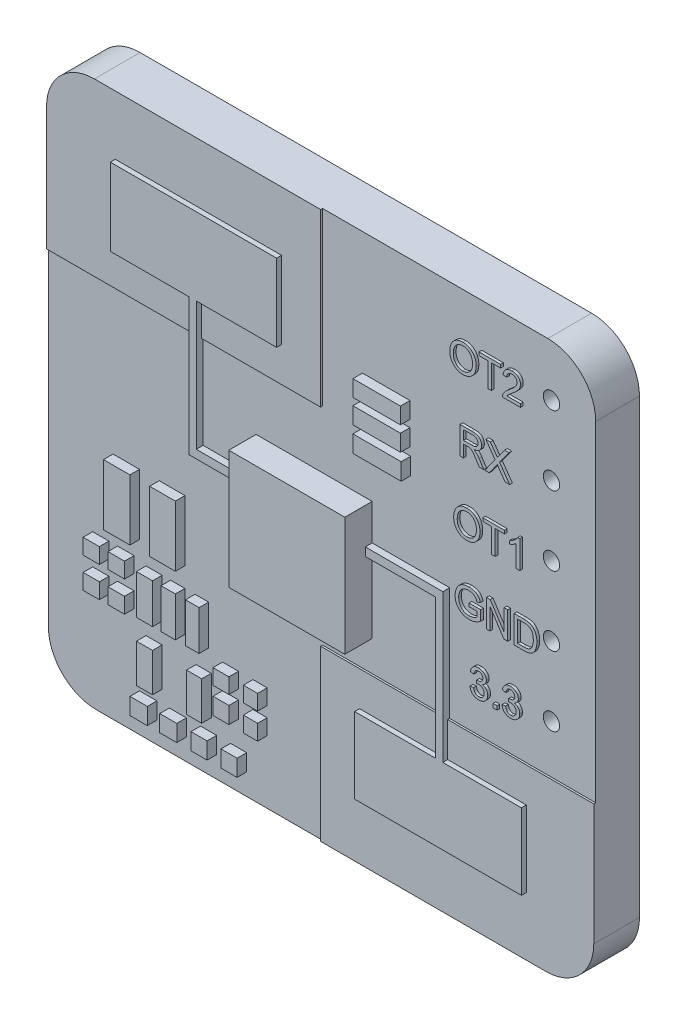
from build123d import *

# Parameters (mm, degrees)
BOSS_EXTRU_1_DEPTH    = 0.25
PUCE_W                = 4.239660345
PUCE_H                = 4.33947132
BOSS_EXTRU_3_DEPTH    = 1
COMPOS_ATES_W         = 0.968097998
COMPOS_ATES_H         = 2.221660789
BOSS_EXTRU_4_DEPTH    = 0.35
COMPOS_ATES_W_2       = 0.940172094
BOSS_EXTRU_4_2_DEPTH  = 0.35
COMPOS_ATES_W_3       = 0.594502212
COMPOS_ATES_H_2       = 0.565693734
BOSS_EXTRU_4_3_DEPTH  = 0.35
COMPOS_ATES_W_4       = 0.604978021
BOSS_EXTRU_4_4_DEPTH  = 0.35
COMPOS_ATES_H_3       = 0.568312687
BOSS_EXTRU_4_5_DEPTH  = 0.35
BOSS_EXTRU_4_6_DEPTH  = 0.35
COMPOS_ATES_W_5       = 0.581460751
COMPOS_ATES_H_4       = 0.561177236
BOSS_EXTRU_4_7_DEPTH  = 0.35
COMPOS_ATES_W_6       = 0.520610207
BOSS_EXTRU_4_8_DEPTH  = 0.35
COMPOS_ATES_H_5       = 0.608505437
BOSS_EXTRU_4_9_DEPTH  = 0.35
COMPOS_ATES_H_6       = 0.567938407
BOSS_EXTRU_4_10_DEPTH = 0.35
COMPOS_ATES_W_7       = 0.635898281
BOSS_EXTRU_4_11_DEPTH = 0.35
COMPOS_ATES_W_8       = 0.622027779
BOSS_EXTRU_4_12_DEPTH = 0.35
COMPOS_ATES_W_9       = 0.588221922
BOSS_EXTRU_4_13_DEPTH = 0.35
COMPOS_ATES_W_10      = 0.588221921
BOSS_EXTRU_4_14_DEPTH = 0.35
COMPOS_ATES_H_7       = 1.406323675
BOSS_EXTRU_4_15_DEPTH = 0.35
COMPOS_ATES_W_11      = 0.554416064
BOSS_EXTRU_4_16_DEPTH = 0.35
COMPOS_ATES_H_8       = 1.453651876
BOSS_EXTRU_4_17_DEPTH = 0.35
COMPOS_ATES_W_12      = 0.523814861
BOSS_EXTRU_4_18_DEPTH = 0.35
COMPOS_ATES_W_13      = 0.496946106
BOSS_EXTRU_4_19_DEPTH = 0.35
COMPOS_ATES_W_14      = 1.738249378
COMPOS_ATES_H_9       = 0.595601276
BOSS_EXTRU_4_20_DEPTH = 0.35
COMPOS_ATES_H_10      = 0.605312167
BOSS_EXTRU_4_21_DEPTH = 0.35
COMPOS_ATES_W_15      = 1.764145085
COMPOS_ATES_H_11      = 0.618260021
BOSS_EXTRU_4_22_DEPTH = 0.35
BOSS_EXTRU_5_DEPTH    = 0.07
BOSS_EXTRU_6_START    = -1.6
PCB_R                 = 0.299595511
BOSS_EXTRU_6_DEPTH    = 1.6
ESQUISSE6_W           = 0.142857143
ESQUISSE6_H           = 0.142857142
BOSS_EXTRU_7_DEPTH    = 0.1


with BuildPart() as part:
    # composants → Boss.-Extru.1 (new body)
    with BuildSketch(Plane.XY):
        Polygon((-82.727562383, 34.479663163), (-82.727562383, 39.174135015), (-79.79361212, 39.174135015), (-79.79361212, 41.997619001), (-85.870529773, 41.997619001), (-85.870529773, 39.174135015), (-82.989687716, 39.174135015), (-82.989687716, 34.479663163), (-82.989687716, 34.176614171), (-82.727562383, 34.176614171), (-73.979075398, 34.176614171), (-73.979075398, 29.073665079), (-76.94287285, 29.073665079), (-76.94287285, 26.301492461), (-70.849203088, 26.301492461), (-70.849203088, 29.073665079), (-73.721056197, 29.073665079), (-73.721056197, 34.176614171), (-73.721056197, 34.479663163), (-73.979075398, 34.479663163), align=None)
    extrude(amount=BOSS_EXTRU_1_DEPTH)

    # puce → Boss.-Extru.3 (add)
    with BuildSketch(Plane.XY):
        with Locations((-78.672400013, 33.624858815)):
            Rectangle(PUCE_W, PUCE_H)
    extrude(amount=BOSS_EXTRU_3_DEPTH)

    # planmasse → Boss.-Extru.5 (add)
    with BuildSketch(Plane.XY):
        with BuildLine():
            Line((-78.364184072, 37.907299389), (-88.38289044, 37.907299389))
            Line((-88.38289044, 37.907299389), (-88.38289044, 42.411344394))
            ThreePointArc((-88.38289044, 42.411344394), (-87.870327307, 43.648781261), (-86.63289044, 44.161344394))
            Line((-86.63289044, 44.161344394), (-78.364184072, 44.161344394))
            Line((-78.364184072, 44.161344394), (-78.364184072, 37.907299389))
        make_face()
        with BuildLine():
            Line((-78.364184072, 30.341178629), (-68.38289044, 30.341178629))
            Line((-68.38289044, 30.341178629), (-68.38289044, 25.911344394))
            ThreePointArc((-68.38289044, 25.911344394), (-68.895453573, 24.673907527), (-70.13289044, 24.161344394))
            Line((-70.13289044, 24.161344394), (-78.364184072, 24.161344394))
            Line((-78.364184072, 24.161344394), (-78.364184072, 30.341178629))
        make_face()
    extrude(amount=BOSS_EXTRU_5_DEPTH)



with BuildPart() as body_2:
    # compos,ates → Boss.-Extru.4 (new body)
    with BuildSketch(Plane.XY):
        with Locations((-85.538547824, 31.447200894)):
            Rectangle(COMPOS_ATES_W, COMPOS_ATES_H)
    extrude(amount=BOSS_EXTRU_4_DEPTH)


with BuildPart() as body_3:
    # compos,ates → Boss.-Extru.4 2 (new body)
    with BuildSketch(Plane.XY):
        with Locations((-83.864545037, 31.447200894)):
            Rectangle(COMPOS_ATES_W_2, COMPOS_ATES_H)
    extrude(amount=BOSS_EXTRU_4_2_DEPTH)


with BuildPart() as body_4:
    # compos,ates → Boss.-Extru.4 3 (new body)
    with BuildSketch(Plane.XY):
        with Locations((-86.468991979, 29.445859909)):
            Rectangle(COMPOS_ATES_W_3, COMPOS_ATES_H_2)
    extrude(amount=BOSS_EXTRU_4_3_DEPTH)


with BuildPart() as body_5:
    # compos,ates → Boss.-Extru.4 4 (new body)
    with BuildSketch(Plane.XY):
        with Locations((-85.554977565, 29.445859909)):
            Rectangle(COMPOS_ATES_W_4, COMPOS_ATES_H_2)
    extrude(amount=BOSS_EXTRU_4_4_DEPTH)


with BuildPart() as body_6:
    # compos,ates → Boss.-Extru.4 5 (new body)
    with BuildSketch(Plane.XY):
        with Locations((-86.468991979, 28.331495632)):
            Rectangle(COMPOS_ATES_W_3, COMPOS_ATES_H_3)
    extrude(amount=BOSS_EXTRU_4_5_DEPTH)


with BuildPart() as body_7:
    # compos,ates → Boss.-Extru.4 6 (new body)
    with BuildSketch(Plane.XY):
        with Locations((-85.554977565, 28.331495632)):
            Rectangle(COMPOS_ATES_W_4, COMPOS_ATES_H_3)
    extrude(amount=BOSS_EXTRU_4_6_DEPTH)


with BuildPart() as body_8:
    # compos,ates → Boss.-Extru.4 7 (new body)
    with BuildSketch(Plane.XY):
        with Locations((-81.727654281, 27.695281108)):
            Rectangle(COMPOS_ATES_W_5, COMPOS_ATES_H_4)
    extrude(amount=BOSS_EXTRU_4_7_DEPTH)


with BuildPart() as body_9:
    # compos,ates → Boss.-Extru.4 8 (new body)
    with BuildSketch(Plane.XY):
        with Locations((-80.649247424, 27.695281108)):
            Rectangle(COMPOS_ATES_W_6, COMPOS_ATES_H_4)
    extrude(amount=BOSS_EXTRU_4_8_DEPTH)


with BuildPart() as body_10:
    # compos,ates → Boss.-Extru.4 9 (new body)
    with BuildSketch(Plane.XY):
        with Locations((-81.727654281, 26.765620025)):
            Rectangle(COMPOS_ATES_W_5, COMPOS_ATES_H_5)
    extrude(amount=BOSS_EXTRU_4_9_DEPTH)


with BuildPart() as body_11:
    # compos,ates → Boss.-Extru.4 10 (new body)
    with BuildSketch(Plane.XY):
        with Locations((-80.649247424, 26.74533651)):
            Rectangle(COMPOS_ATES_W_6, COMPOS_ATES_H_6)
    extrude(amount=BOSS_EXTRU_4_10_DEPTH)


with BuildPart() as body_12:
    # compos,ates → Boss.-Extru.4 11 (new body)
    with BuildSketch(Plane.XY):
        with Locations((-84.736549685, 25.244356434)):
            Rectangle(COMPOS_ATES_W_7, COMPOS_ATES_H_5)
    extrude(amount=BOSS_EXTRU_4_11_DEPTH)


with BuildPart() as body_13:
    # compos,ates → Boss.-Extru.4 12 (new body)
    with BuildSketch(Plane.XY):
        with Locations((-83.654588163, 25.244356434)):
            Rectangle(COMPOS_ATES_W_8, COMPOS_ATES_H_5)
    extrude(amount=BOSS_EXTRU_4_12_DEPTH)


with BuildPart() as body_14:
    # compos,ates → Boss.-Extru.4 13 (new body)
    with BuildSketch(Plane.XY):
        with Locations((-82.528853105, 25.244356434)):
            Rectangle(COMPOS_ATES_W_9, COMPOS_ATES_H_5)
    extrude(amount=BOSS_EXTRU_4_13_DEPTH)


with BuildPart() as body_15:
    # compos,ates → Boss.-Extru.4 14 (new body)
    with BuildSketch(Plane.XY):
        with Locations((-81.43354332, 25.244356434)):
            Rectangle(COMPOS_ATES_W_10, COMPOS_ATES_H_5)
    extrude(amount=BOSS_EXTRU_4_14_DEPTH)


with BuildPart() as body_16:
    # compos,ates → Boss.-Extru.4 15 (new body)
    with BuildSketch(Plane.XY):
        with Locations((-84.523398702, 26.711530653)):
            Rectangle(COMPOS_ATES_W_9, COMPOS_ATES_H_7)
    extrude(amount=BOSS_EXTRU_4_15_DEPTH)


with BuildPart() as body_17:
    # compos,ates → Boss.-Extru.4 16 (new body)
    with BuildSketch(Plane.XY):
        with Locations((-82.70802415, 26.711530653)):
            Rectangle(COMPOS_ATES_W_11, COMPOS_ATES_H_7)
    extrude(amount=BOSS_EXTRU_4_16_DEPTH)


with BuildPart() as body_18:
    # compos,ates → Boss.-Extru.4 17 (new body)
    with BuildSketch(Plane.XY):
        with Locations((-84.523398702, 28.892008466)):
            Rectangle(COMPOS_ATES_W_9, COMPOS_ATES_H_8)
    extrude(amount=BOSS_EXTRU_4_17_DEPTH)


with BuildPart() as body_19:
    # compos,ates → Boss.-Extru.4 18 (new body)
    with BuildSketch(Plane.XY):
        with Locations((-83.656366421, 28.892008466)):
            Rectangle(COMPOS_ATES_W_12, COMPOS_ATES_H_8)
    extrude(amount=BOSS_EXTRU_4_18_DEPTH)


with BuildPart() as body_20:
    # compos,ates → Boss.-Extru.4 19 (new body)
    with BuildSketch(Plane.XY):
        with Locations((-82.777326158, 28.892008466)):
            Rectangle(COMPOS_ATES_W_13, COMPOS_ATES_H_8)
    extrude(amount=BOSS_EXTRU_4_19_DEPTH)


with BuildPart() as body_21:
    # compos,ates → Boss.-Extru.4 20 (new body)
    with BuildSketch(Plane.XY):
        with Locations((-76.03749441, 39.38072464)):
            Rectangle(COMPOS_ATES_W_14, COMPOS_ATES_H_9)
    extrude(amount=BOSS_EXTRU_4_20_DEPTH)


with BuildPart() as body_22:
    # compos,ates → Boss.-Extru.4 21 (new body)
    with BuildSketch(Plane.XY):
        with Locations((-76.03749441, 38.518073878)):
            Rectangle(COMPOS_ATES_W_14, COMPOS_ATES_H_10)
    extrude(amount=BOSS_EXTRU_4_21_DEPTH)


with BuildPart() as body_23:
    # compos,ates → Boss.-Extru.4 22 (new body)
    with BuildSketch(Plane.XY):
        with Locations((-76.024546557, 37.621435)):
            Rectangle(COMPOS_ATES_W_15, COMPOS_ATES_H_11)
    extrude(amount=BOSS_EXTRU_4_22_DEPTH)


with BuildPart() as part_1:
    add(part.part)

    add(body_2.part)  # Boss.-Extru.6 merges body 2

    add(body_3.part)  # Boss.-Extru.6 merges body 3

    add(body_4.part)  # Boss.-Extru.6 merges body 4

    add(body_5.part)  # Boss.-Extru.6 merges body 5

    add(body_6.part)  # Boss.-Extru.6 merges body 6

    add(body_7.part)  # Boss.-Extru.6 merges body 7

    add(body_8.part)  # Boss.-Extru.6 merges body 8

    add(body_9.part)  # Boss.-Extru.6 merges body 9

    add(body_10.part)  # Boss.-Extru.6 merges body 10

    add(body_11.part)  # Boss.-Extru.6 merges body 11

    add(body_12.part)  # Boss.-Extru.6 merges body 12

    add(body_13.part)  # Boss.-Extru.6 merges body 13

    add(body_14.part)  # Boss.-Extru.6 merges body 14

    add(body_15.part)  # Boss.-Extru.6 merges body 15

    add(body_16.part)  # Boss.-Extru.6 merges body 16

    add(body_17.part)  # Boss.-Extru.6 merges body 17

    add(body_18.part)  # Boss.-Extru.6 merges body 18

    add(body_19.part)  # Boss.-Extru.6 merges body 19

    add(body_20.part)  # Boss.-Extru.6 merges body 20

    add(body_21.part)  # Boss.-Extru.6 merges body 21

    add(body_22.part)  # Boss.-Extru.6 merges body 22

    add(body_23.part)  # Boss.-Extru.6 merges body 23
    # pcb → Boss.-Extru.6 (add)
    with BuildSketch(Plane.XY.offset(BOSS_EXTRU_6_START)):
        with BuildLine():
            Line((-88.38289044, 42.411344394), (-88.38289044, 37.932925771))
            Line((-88.38289044, 37.932925771), (-88.38289044, 25.911344394))
            ThreePointArc((-88.38289044, 25.911344394), (-87.870327307, 24.673907527), (-86.63289044, 24.161344394))
            Line((-86.63289044, 24.161344394), (-70.13289044, 24.161344394))
            ThreePointArc((-70.13289044, 24.161344394), (-68.895453573, 24.673907527), (-68.38289044, 25.911344394))
            Line((-68.38289044, 25.911344394), (-68.38289044, 42.411344394))
            ThreePointArc((-68.38289044, 42.411344394), (-68.895453573, 43.648781261), (-70.13289044, 44.161344394))
            Line((-70.13289044, 44.161344394), (-86.63289044, 44.161344394))
            ThreePointArc((-86.63289044, 44.161344394), (-87.870327307, 43.648781261), (-88.38289044, 42.411344394))
        make_face()
        with Locations((-69.999251018, 32.112389016)):
            Circle(PCB_R, mode=Mode.SUBTRACT)
        with Locations((-69.999251018, 34.652389016)):
            Circle(PCB_R, mode=Mode.SUBTRACT)
        with Locations((-69.999251018, 37.192389016)):
            Circle(PCB_R, mode=Mode.SUBTRACT)
        with Locations((-69.999251018, 39.732389016)):
            Circle(PCB_R, mode=Mode.SUBTRACT)
        with Locations((-69.999251018, 42.272389016)):
            Circle(PCB_R, mode=Mode.SUBTRACT)
    extrude(amount=BOSS_EXTRU_6_DEPTH)

    # Esquisse6 → Boss.-Extru.7 (add)
    # profile 1 of 14: a face of its own
    with BuildSketch(Plane.XY):
        with BuildLine():
            add(Edge.make_bspline(
                [(-72.416988653, 32.110058179), (-72.409381043, 32.108428609), (-72.394470894, 32.105234815), (-72.373021148, 32.09833025), (-72.353148019, 32.089491337), (-72.334478472, 32.079468666), (-72.317495516, 32.06726849), (-72.301917932, 32.053541092), (-72.287730346, 32.038083432), (-72.275077561, 32.021185831), (-72.264120415, 32.003157669), (-72.254213405, 31.984796941), (-72.245929262, 31.966004093), (-72.239180953, 31.946728119), (-72.233884703, 31.927136894), (-72.230259257, 31.907038916), (-72.22796943, 31.886626243), (-72.227629699, 31.87284821), (-72.227459432, 31.865942919)],
                knots=[0, 0, 0, 0, 1.108697074, 2.172934788, 3.204880389, 4.206093888, 5.188037506, 6.178607442, 7.161308294, 8.17378834, 9.182634384, 10.166186428, 11.146234401, 12.106878305, 13.075234477, 14.036023556, 15.015691959, 16, 16, 16, 16], degree=3))
            add(Edge.make_bspline(
                [(-72.227459432, 31.865942919), (-72.227798259, 31.854903758), (-72.228464178, 31.833207793), (-72.232908352, 31.801410743), (-72.24064398, 31.771201942), (-72.25155368, 31.742528078), (-72.265288802, 31.715179707), (-72.282531694, 31.689597615), (-72.302573714, 31.665380293), (-72.325569394, 31.643168434), (-72.350601927, 31.622982407), (-72.377080684, 31.60524909), (-72.404740101, 31.590107136), (-72.433744752, 31.57794908), (-72.463869962, 31.568297448), (-72.495291428, 31.561707819), (-72.527873795, 31.557513252), (-72.550024869, 31.556966926), (-72.56126625, 31.556689673)],
                knots=[0, 0, 0, 0, 1.04348772, 2.050832607, 3.027849651, 3.985018456, 4.945832333, 5.91410632, 6.89488226, 7.912262782, 8.930828092, 9.931024771, 10.921011636, 11.90669419, 12.899588269, 13.906628715, 14.937641313, 16, 16, 16, 16], degree=3))
            add(Edge.make_bspline(
                [(-72.56126625, 31.556689673), (-72.571966035, 31.556906011), (-72.592956544, 31.557330416), (-72.623673767, 31.561179908), (-72.653030824, 31.566815077), (-72.680782795, 31.575591212), (-72.707347994, 31.586199798), (-72.732291904, 31.599694389), (-72.755844255, 31.615482759), (-72.777887225, 31.63339269), (-72.797926272, 31.653579664), (-72.816061193, 31.675216168), (-72.831812835, 31.698656212), (-72.845379446, 31.723500109), (-72.856623535, 31.750038686), (-72.865697019, 31.778009444), (-72.872727027, 31.807594594), (-72.875431882, 31.827965815), (-72.876810081, 31.838345517)],
                knots=[0, 0, 0, 0, 1.097840809, 2.15371029, 3.173627445, 4.161928108, 5.136697, 6.10591076, 7.066857035, 8.04392302, 9.016042305, 9.982391694, 10.93757629, 11.910092237, 12.8837972, 13.891636589, 14.925730372, 16, 16, 16, 16], degree=3))
            Line((-72.876810081, 31.838345517), (-72.746939951, 31.855390971))
            add(Edge.make_bspline(
                [(-72.746939951, 31.855390971), (-72.745417215, 31.847454367), (-72.742456454, 31.832022678), (-72.736477324, 31.809904636), (-72.729841725, 31.789258938), (-72.722118067, 31.770131538), (-72.713492221, 31.752527267), (-72.703840422, 31.736559327), (-72.693486012, 31.72202833), (-72.682148433, 31.708954667), (-72.669647919, 31.697600214), (-72.656441204, 31.687507517), (-72.642126848, 31.679136717), (-72.626822044, 31.672492265), (-72.610660495, 31.667168851), (-72.593549518, 31.663289406), (-72.575460514, 31.661090131), (-72.563098338, 31.660755972), (-72.556801964, 31.660585776)],
                knots=[0, 0, 0, 0, 1.291404279, 2.510966685, 3.659843074, 4.756126606, 5.80544111, 6.790091746, 7.735305102, 8.654813164, 9.550164339, 10.430304926, 11.307451716, 12.193417606, 13.092677492, 14.023872142, 14.99350733, 16, 16, 16, 16], degree=3))
            add(Edge.make_bspline(
                [(-72.556801964, 31.660585776), (-72.549964033, 31.660813976), (-72.536508367, 31.661263026), (-72.516681702, 31.663821369), (-72.497786945, 31.668643324), (-72.479515645, 31.674797637), (-72.462274368, 31.68336727), (-72.445470288, 31.693142611), (-72.429907374, 31.705336541), (-72.415102682, 31.718832681), (-72.401641736, 31.733707711), (-72.389771644, 31.749584082), (-72.379827355, 31.766367582), (-72.371376714, 31.783804407), (-72.365059539, 31.802286256), (-72.360744577, 31.821554944), (-72.357658537, 31.841561686), (-72.357440336, 31.855175904), (-72.357329562, 31.8620874)],
                knots=[0, 0, 0, 0, 1.039414619, 2.045357549, 3.030071188, 3.998775674, 4.968788042, 5.950654362, 6.947736046, 7.966204168, 8.99226847, 9.991361361, 10.97322768, 11.952508152, 12.930925156, 13.933238126, 14.950772207, 16, 16, 16, 16], degree=3))
            add(Edge.make_bspline(
                [(-72.357329562, 31.8620874), (-72.357455261, 31.868727025), (-72.357701305, 31.881723486), (-72.360532452, 31.900791619), (-72.364639681, 31.919059805), (-72.370794757, 31.936384888), (-72.378646055, 31.95277743), (-72.387893245, 31.968477871), (-72.399218171, 31.983176915), (-72.412138838, 31.996826402), (-72.42627289, 32.009395718), (-72.441542496, 32.020517174), (-72.458067993, 32.029537201), (-72.475483299, 32.037198618), (-72.494004661, 32.04301293), (-72.513547397, 32.047322451), (-72.534148792, 32.049739798), (-72.548205505, 32.050041928), (-72.55538151, 32.050196166)],
                knots=[0, 0, 0, 0, 1.039520793, 2.03476737, 3.014257368, 3.969595977, 4.908269218, 5.858892987, 6.819157264, 7.808857987, 8.799919747, 9.779409745, 10.761476676, 11.744001019, 12.756257763, 13.797775717, 14.875756186, 16, 16, 16, 16], degree=3))
            add(Edge.make_bspline(
                [(-72.55538151, 32.050196166), (-72.5616788, 32.05002262), (-72.574991195, 32.049655745), (-72.595924557, 32.047015727), (-72.618889046, 32.042975192), (-72.634742386, 32.039190811), (-72.643043847, 32.037209153)],
                knots=[0, 0, 0, 0, 0.850710824, 1.798392532, 2.847147604, 4, 4, 4, 4], degree=3))
            Line((-72.643043847, 32.037209153), (-72.629042224, 32.15409227))
            add(Edge.make_bspline(
                [(-72.629042224, 32.15409227), (-72.621396261, 32.154073812), (-72.606975772, 32.154039), (-72.586626009, 32.155288806), (-72.568792195, 32.156242667), (-72.552828032, 32.158299236), (-72.537778851, 32.16170353), (-72.522332838, 32.166397518), (-72.506197003, 32.173021337), (-72.489340754, 32.180876199), (-72.472826731, 32.190680959), (-72.457423633, 32.202467734), (-72.443840965, 32.216490137), (-72.43149511, 32.23204319), (-72.421415534, 32.249825867), (-72.414382709, 32.269740744), (-72.409990196, 32.291617635), (-72.409521487, 32.306870424), (-72.409277614, 32.314806556)],
                knots=[0, 0, 0, 0, 1.189476569, 2.243384405, 3.171816706, 3.968247766, 4.74460194, 5.57033408, 6.477275893, 7.456583362, 8.462071333, 9.460038224, 10.464864835, 11.49237022, 12.543383061, 13.628830431, 14.766264109, 16, 16, 16, 16], degree=3))
            add(Edge.make_bspline(
                [(-72.409277614, 32.314806556), (-72.409464726, 32.320627753), (-72.409829218, 32.331967366), (-72.411755872, 32.34851952), (-72.415485985, 32.363996576), (-72.420463958, 32.378579452), (-72.427369214, 32.391970136), (-72.435125666, 32.404719478), (-72.444849824, 32.416117009), (-72.459357872, 32.429706655), (-72.479445741, 32.444117573), (-72.505926487, 32.45656078), (-72.534292876, 32.46453397), (-72.553907703, 32.465359736), (-72.563904237, 32.465780582)],
                knots=[0, 0, 0, 0, 0.865373357, 1.68573535, 2.470791522, 3.227405046, 3.969116108, 4.705358259, 5.440226823, 6.186825656, 7.656768999, 9.091088923, 10.517497636, 12, 12, 12, 12], degree=3))
            add(Edge.make_bspline(
                [(-72.563904237, 32.465780582), (-72.569592762, 32.465611729), (-72.580810735, 32.465278745), (-72.597196766, 32.463043468), (-72.612805486, 32.459321888), (-72.627662169, 32.454386883), (-72.641570118, 32.447479832), (-72.65478449, 32.439464629), (-72.667115457, 32.429725075), (-72.678575516, 32.418624507), (-72.68919874, 32.406250247), (-72.698562364, 32.392421024), (-72.707083677, 32.37744226), (-72.714560996, 32.361132773), (-72.721126756, 32.34366714), (-72.726242513, 32.324868991), (-72.730855244, 32.304927013), (-72.732900828, 32.291082888), (-72.733952938, 32.2839624)],
                knots=[0, 0, 0, 0, 0.991350633, 1.954978605, 2.875684831, 3.785306039, 4.676327725, 5.576040997, 6.474517762, 7.408263042, 8.35317801, 9.311237712, 10.314294325, 11.353349771, 12.435063167, 13.562077035, 14.746096111, 16, 16, 16, 16], degree=3))
            Line((-72.733952938, 32.2839624), (-72.863823068, 32.306689673))
            add(Edge.make_bspline(
                [(-72.863823068, 32.306689673), (-72.861772628, 32.31735321), (-72.857752404, 32.338260832), (-72.848801153, 32.368120264), (-72.838928371, 32.396201559), (-72.826472383, 32.421830306), (-72.812902776, 32.445796697), (-72.796844715, 32.467224438), (-72.779598397, 32.487058862), (-72.760213086, 32.504387563), (-72.739616212, 32.51978539), (-72.717869368, 32.53300434), (-72.695331353, 32.5445941), (-72.67153397, 32.553464994), (-72.647012066, 32.561062858), (-72.62135286, 32.565960484), (-72.594760306, 32.569117253), (-72.576697658, 32.569488707), (-72.567556834, 32.569676686)],
                knots=[0, 0, 0, 0, 1.196598026, 2.346127519, 3.433890862, 4.474795076, 5.484142389, 6.465743017, 7.422110934, 8.377896977, 9.32664338, 10.254070249, 11.18137714, 12.11636131, 13.050809827, 14.008921245, 14.99239035, 16, 16, 16, 16], degree=3))
            add(Edge.make_bspline(
                [(-72.567556834, 32.569676686), (-72.557469168, 32.569433613), (-72.537706942, 32.568957423), (-72.508694212, 32.565488396), (-72.481015984, 32.559546942), (-72.454514608, 32.551537369), (-72.429440492, 32.540828296), (-72.405512648, 32.528050845), (-72.382980014, 32.512688306), (-72.361731357, 32.495430906), (-72.34271025, 32.4762064), (-72.325592875, 32.456108304), (-72.311345244, 32.434696204), (-72.29973679, 32.412206557), (-72.29044921, 32.38872102), (-72.284053477, 32.364120732), (-72.280018796, 32.3384793), (-72.279613719, 32.321044891), (-72.279407484, 32.312168569)],
                knots=[0, 0, 0, 0, 1.123761111, 2.201502124, 3.249427722, 4.274422765, 5.280770574, 6.282168429, 7.291699599, 8.314503797, 9.32695594, 10.300518959, 11.251508239, 12.185140702, 13.11575736, 14.058951515, 15.011760414, 16, 16, 16, 16], degree=3))
            add(Edge.make_bspline(
                [(-72.279407484, 32.312168569), (-72.279849852, 32.30098015), (-72.280709825, 32.27922965), (-72.286983267, 32.247811289), (-72.297949015, 32.218961225), (-72.313066935, 32.19239691), (-72.332888234, 32.168537714), (-72.356765514, 32.146979193), (-72.385023402, 32.127978378), (-72.406088599, 32.117907354), (-72.416988653, 32.112696166)],
                knots=[0, 0, 0, 0, 1.039587536, 2.020978204, 2.96205572, 3.896981787, 4.848417189, 5.832040328, 6.87820286, 8, 8, 8, 8], degree=3))
            Line((-72.416988653, 32.112696166), (-72.416988653, 32.110058179))
        make_face()
    # profile 2 of 14: a face of its own
    with BuildSketch(Plane.XY):
        with Locations((-71.961225665, 31.641105257)):
            Rectangle(ESQUISSE6_W, ESQUISSE6_H)
    # profile 3 of 14: a face of its own
    with BuildSketch(Plane.XY):
        with BuildLine():
            add(Edge.make_bspline(
                [(-71.248157484, 32.110058179), (-71.240549874, 32.108428609), (-71.225639725, 32.105234815), (-71.204189979, 32.09833025), (-71.18431685, 32.089491337), (-71.165647303, 32.079468666), (-71.148664347, 32.06726849), (-71.133086763, 32.053541092), (-71.118899177, 32.038083432), (-71.106246392, 32.021185831), (-71.095289246, 32.003157669), (-71.085382237, 31.984796941), (-71.077098093, 31.966004093), (-71.070349784, 31.946728119), (-71.065053534, 31.927136894), (-71.061428088, 31.907038916), (-71.059138261, 31.886626243), (-71.05879853, 31.87284821), (-71.058628263, 31.865942919)],
                knots=[0, 0, 0, 0, 1.108697074, 2.172934788, 3.204880389, 4.206093888, 5.188037506, 6.178607442, 7.161308294, 8.17378834, 9.182634384, 10.166186428, 11.146234401, 12.106878305, 13.075234477, 14.036023556, 15.015691959, 16, 16, 16, 16], degree=3))
            add(Edge.make_bspline(
                [(-71.058628263, 31.865942919), (-71.058967091, 31.854903758), (-71.05963301, 31.833207793), (-71.064077183, 31.801410743), (-71.071812811, 31.771201942), (-71.082722511, 31.742528078), (-71.096457633, 31.715179707), (-71.113700526, 31.689597615), (-71.133742545, 31.665380293), (-71.156738225, 31.643168434), (-71.181770758, 31.622982407), (-71.208249516, 31.60524909), (-71.235908932, 31.590107136), (-71.264913583, 31.57794908), (-71.295038793, 31.568297448), (-71.326460259, 31.561707819), (-71.359042626, 31.557513252), (-71.3811937, 31.556966926), (-71.392435081, 31.556689673)],
                knots=[0, 0, 0, 0, 1.04348772, 2.050832607, 3.027849651, 3.985018456, 4.945832333, 5.91410632, 6.89488226, 7.912262782, 8.930828092, 9.931024771, 10.921011636, 11.90669419, 12.899588269, 13.906628715, 14.937641313, 16, 16, 16, 16], degree=3))
            add(Edge.make_bspline(
                [(-71.392435081, 31.556689673), (-71.403134866, 31.556906011), (-71.424125375, 31.557330416), (-71.454842598, 31.561179908), (-71.484199655, 31.566815077), (-71.511951626, 31.575591212), (-71.538516826, 31.586199798), (-71.563460735, 31.599694389), (-71.587013086, 31.615482759), (-71.609056056, 31.63339269), (-71.629095103, 31.653579664), (-71.647230024, 31.675216168), (-71.662981666, 31.698656212), (-71.676548278, 31.723500109), (-71.687792366, 31.750038686), (-71.69686585, 31.778009444), (-71.703895858, 31.807594594), (-71.706600713, 31.827965815), (-71.707978912, 31.838345517)],
                knots=[0, 0, 0, 0, 1.097840809, 2.15371029, 3.173627445, 4.161928108, 5.136697, 6.10591076, 7.066857035, 8.04392302, 9.016042305, 9.982391694, 10.93757629, 11.910092237, 12.8837972, 13.891636589, 14.925730372, 16, 16, 16, 16], degree=3))
            Line((-71.707978912, 31.838345517), (-71.578108783, 31.855390971))
            add(Edge.make_bspline(
                [(-71.578108783, 31.855390971), (-71.576586046, 31.847454367), (-71.573625285, 31.832022678), (-71.567646155, 31.809904636), (-71.561010556, 31.789258938), (-71.553286899, 31.770131538), (-71.544661053, 31.752527267), (-71.535009253, 31.736559327), (-71.524654843, 31.72202833), (-71.513317264, 31.708954667), (-71.500816751, 31.697600214), (-71.487610035, 31.687507517), (-71.473295679, 31.679136717), (-71.457990875, 31.672492265), (-71.441829326, 31.667168851), (-71.424718349, 31.663289406), (-71.406629345, 31.661090131), (-71.394267169, 31.660755972), (-71.387970796, 31.660585776)],
                knots=[0, 0, 0, 0, 1.291404279, 2.510966685, 3.659843074, 4.756126606, 5.80544111, 6.790091746, 7.735305102, 8.654813164, 9.550164339, 10.430304926, 11.307451716, 12.193417606, 13.092677492, 14.023872142, 14.99350733, 16, 16, 16, 16], degree=3))
            add(Edge.make_bspline(
                [(-71.387970796, 31.660585776), (-71.381132864, 31.660813976), (-71.367677198, 31.661263026), (-71.347850533, 31.663821369), (-71.328955777, 31.668643324), (-71.310684476, 31.674797637), (-71.293443199, 31.68336727), (-71.276639119, 31.693142611), (-71.261076205, 31.705336541), (-71.246271513, 31.718832681), (-71.232810567, 31.733707711), (-71.220940475, 31.749584082), (-71.210996186, 31.766367582), (-71.202545545, 31.783804407), (-71.19622837, 31.802286256), (-71.191913408, 31.821554944), (-71.188827368, 31.841561686), (-71.188609167, 31.855175904), (-71.188498393, 31.8620874)],
                knots=[0, 0, 0, 0, 1.039414619, 2.045357549, 3.030071188, 3.998775674, 4.968788042, 5.950654362, 6.947736046, 7.966204168, 8.99226847, 9.991361361, 10.97322768, 11.952508152, 12.930925156, 13.933238126, 14.950772207, 16, 16, 16, 16], degree=3))
            add(Edge.make_bspline(
                [(-71.188498393, 31.8620874), (-71.188624092, 31.868727025), (-71.188870136, 31.881723486), (-71.191701283, 31.900791619), (-71.195808512, 31.919059805), (-71.201963588, 31.936384888), (-71.209814886, 31.95277743), (-71.219062076, 31.968477871), (-71.230387002, 31.983176915), (-71.243307669, 31.996826402), (-71.257441722, 32.009395718), (-71.272711327, 32.020517174), (-71.289236824, 32.029537201), (-71.30665213, 32.037198618), (-71.325173493, 32.04301293), (-71.344716228, 32.047322451), (-71.365317623, 32.049739798), (-71.379374336, 32.050041928), (-71.386550341, 32.050196166)],
                knots=[0, 0, 0, 0, 1.039520793, 2.03476737, 3.014257368, 3.969595977, 4.908269218, 5.858892987, 6.819157264, 7.808857987, 8.799919747, 9.779409745, 10.761476676, 11.744001019, 12.756257763, 13.797775717, 14.875756186, 16, 16, 16, 16], degree=3))
            add(Edge.make_bspline(
                [(-71.386550341, 32.050196166), (-71.392847631, 32.05002262), (-71.406160026, 32.049655745), (-71.427093388, 32.047015727), (-71.450057877, 32.042975192), (-71.465911217, 32.039190811), (-71.474212679, 32.037209153)],
                knots=[0, 0, 0, 0, 0.850710824, 1.798392532, 2.847147604, 4, 4, 4, 4], degree=3))
            Line((-71.474212679, 32.037209153), (-71.460211055, 32.15409227))
            add(Edge.make_bspline(
                [(-71.460211055, 32.15409227), (-71.452565092, 32.154073812), (-71.438144603, 32.154039), (-71.41779484, 32.155288806), (-71.399961026, 32.156242667), (-71.383996863, 32.158299236), (-71.368947683, 32.16170353), (-71.353501669, 32.166397518), (-71.337365834, 32.173021337), (-71.320509586, 32.180876199), (-71.303995563, 32.190680959), (-71.288592464, 32.202467734), (-71.275009797, 32.216490137), (-71.262663941, 32.23204319), (-71.252584365, 32.249825867), (-71.24555154, 32.269740744), (-71.241159027, 32.291617635), (-71.240690318, 32.306870424), (-71.240446445, 32.314806556)],
                knots=[0, 0, 0, 0, 1.189476569, 2.243384405, 3.171816706, 3.968247766, 4.74460194, 5.57033408, 6.477275893, 7.456583362, 8.462071333, 9.460038224, 10.464864835, 11.49237022, 12.543383061, 13.628830431, 14.766264109, 16, 16, 16, 16], degree=3))
            add(Edge.make_bspline(
                [(-71.240446445, 32.314806556), (-71.240633557, 32.320627753), (-71.240998049, 32.331967366), (-71.242924703, 32.34851952), (-71.246654816, 32.363996576), (-71.251632789, 32.378579452), (-71.258538045, 32.391970136), (-71.266294497, 32.404719478), (-71.276018655, 32.416117009), (-71.290526703, 32.429706655), (-71.310614572, 32.444117573), (-71.337095318, 32.45656078), (-71.365461707, 32.46453397), (-71.385076534, 32.465359736), (-71.395073068, 32.465780582)],
                knots=[0, 0, 0, 0, 0.865373357, 1.68573535, 2.470791522, 3.227405046, 3.969116108, 4.705358259, 5.440226823, 6.186825656, 7.656768999, 9.091088923, 10.517497636, 12, 12, 12, 12], degree=3))
            add(Edge.make_bspline(
                [(-71.395073068, 32.465780582), (-71.400761593, 32.465611729), (-71.411979566, 32.465278745), (-71.428365598, 32.463043468), (-71.443974317, 32.459321888), (-71.458831, 32.454386883), (-71.472738949, 32.447479832), (-71.485953321, 32.439464629), (-71.498284288, 32.429725075), (-71.509744348, 32.418624507), (-71.520367571, 32.406250247), (-71.529731195, 32.392421024), (-71.538252508, 32.37744226), (-71.545729828, 32.361132773), (-71.552295587, 32.34366714), (-71.557411344, 32.324868991), (-71.562024075, 32.304927013), (-71.564069659, 32.291082888), (-71.56512177, 32.2839624)],
                knots=[0, 0, 0, 0, 0.991350633, 1.954978605, 2.875684831, 3.785306039, 4.676327725, 5.576040997, 6.474517762, 7.408263042, 8.35317801, 9.311237712, 10.314294325, 11.353349771, 12.435063167, 13.562077035, 14.746096111, 16, 16, 16, 16], degree=3))
            Line((-71.56512177, 32.2839624), (-71.694991899, 32.306689673))
            add(Edge.make_bspline(
                [(-71.694991899, 32.306689673), (-71.69294146, 32.31735321), (-71.688921235, 32.338260832), (-71.679969985, 32.368120264), (-71.670097202, 32.396201559), (-71.657641214, 32.421830306), (-71.644071607, 32.445796697), (-71.628013547, 32.467224438), (-71.610767229, 32.487058862), (-71.591381917, 32.504387563), (-71.570785043, 32.51978539), (-71.549038199, 32.53300434), (-71.526500185, 32.5445941), (-71.502702801, 32.553464994), (-71.478180898, 32.561062858), (-71.452521692, 32.565960484), (-71.425929137, 32.569117253), (-71.407866489, 32.569488707), (-71.398725666, 32.569676686)],
                knots=[0, 0, 0, 0, 1.196598026, 2.346127519, 3.433890862, 4.474795076, 5.484142389, 6.465743017, 7.422110934, 8.377896977, 9.32664338, 10.254070249, 11.18137714, 12.11636131, 13.050809827, 14.008921245, 14.99239035, 16, 16, 16, 16], degree=3))
            add(Edge.make_bspline(
                [(-71.398725666, 32.569676686), (-71.388637999, 32.569433613), (-71.368875774, 32.568957423), (-71.339863043, 32.565488396), (-71.312184815, 32.559546942), (-71.28568344, 32.551537369), (-71.260609323, 32.540828296), (-71.236681479, 32.528050845), (-71.214148845, 32.512688306), (-71.192900188, 32.495430906), (-71.173879081, 32.4762064), (-71.156761706, 32.456108304), (-71.142514075, 32.434696204), (-71.130905621, 32.412206557), (-71.121618041, 32.38872102), (-71.115222308, 32.364120732), (-71.111187627, 32.3384793), (-71.11078255, 32.321044891), (-71.110576315, 32.312168569)],
                knots=[0, 0, 0, 0, 1.123761111, 2.201502124, 3.249427722, 4.274422765, 5.280770574, 6.282168429, 7.291699599, 8.314503797, 9.32695594, 10.300518959, 11.251508239, 12.185140702, 13.11575736, 14.058951515, 15.011760414, 16, 16, 16, 16], degree=3))
            add(Edge.make_bspline(
                [(-71.110576315, 32.312168569), (-71.111018683, 32.30098015), (-71.111878656, 32.27922965), (-71.118152098, 32.247811289), (-71.129117846, 32.218961225), (-71.144235766, 32.19239691), (-71.164057065, 32.168537714), (-71.187934345, 32.146979193), (-71.216192233, 32.127978378), (-71.23725743, 32.117907354), (-71.248157484, 32.112696166)],
                knots=[0, 0, 0, 0, 1.039587536, 2.020978204, 2.96205572, 3.896981787, 4.848417189, 5.832040328, 6.87820286, 8, 8, 8, 8], degree=3))
            Line((-71.248157484, 32.112696166), (-71.248157484, 32.110058179))
        make_face()
    # profile 4 of 14: a face of its own
    with BuildSketch(Plane.XY):
        with BuildLine():
            add(Edge.make_bspline(
                [(-72.484502781, 34.085272184), (-72.500401961, 34.072951432), (-72.531736718, 34.048669189), (-72.581561127, 34.017565191), (-72.632076831, 33.990687447), (-72.683967954, 33.969127431), (-72.736913883, 33.952200047), (-72.790998628, 33.939943696), (-72.846317981, 33.932696261), (-72.883561813, 33.931737299), (-72.90231934, 33.931254327)],
                knots=[0, 0, 0, 0, 1.062167818, 2.093363956, 3.098910828, 4.082561725, 5.057978033, 6.03252315, 7.009097657, 8, 8, 8, 8], degree=3))
            add(Edge.make_bspline(
                [(-72.90231934, 33.931254327), (-72.921278823, 33.931672578), (-72.958298522, 33.932489243), (-73.012403715, 33.939170392), (-73.063735632, 33.949763769), (-73.11231113, 33.964995201), (-73.157922956, 33.984817229), (-73.200915721, 34.008660043), (-73.241054675, 34.036948781), (-73.277920773, 34.069631162), (-73.311045276, 34.105904866), (-73.340455019, 34.144976769), (-73.364758555, 34.187363175), (-73.385067065, 34.232350879), (-73.400375284, 34.280406288), (-73.411534707, 34.331132881), (-73.418356729, 34.384735111), (-73.419158066, 34.42142614), (-73.419567717, 34.440182898)],
                knots=[0, 0, 0, 0, 1.112342068, 2.171924717, 3.194145695, 4.184707087, 5.153685102, 6.107948005, 7.065022213, 8.029599464, 8.99329415, 9.943618861, 10.893412822, 11.85469267, 12.835116658, 13.847369422, 14.899557418, 16, 16, 16, 16], degree=3))
            add(Edge.make_bspline(
                [(-73.419567717, 34.440182898), (-73.419336069, 34.451820684), (-73.418876237, 34.47492221), (-73.416313177, 34.509294858), (-73.411488706, 34.542988414), (-73.405374352, 34.57618177), (-73.396867752, 34.608624477), (-73.387074519, 34.640630012), (-73.374937918, 34.671829453), (-73.361459778, 34.702468348), (-73.346199537, 34.732004688), (-73.328881645, 34.759825682), (-73.309952238, 34.785987492), (-73.289167279, 34.810318401), (-73.266869446, 34.83320207), (-73.242564979, 34.854054822), (-73.21677705, 34.873479753), (-73.189097702, 34.890876424), (-73.159844818, 34.906557498), (-73.12899394, 34.92017422), (-73.096444271, 34.93150767), (-73.06245406, 34.941071153), (-73.026783919, 34.948401936), (-72.989543508, 34.953277597), (-72.950747576, 34.956749199), (-72.924310659, 34.957066632), (-72.910842067, 34.957228353)],
                knots=[0, 0, 0, 0, 1.023032102, 2.030764463, 3.027120614, 4.013582926, 4.995573987, 5.97339874, 6.953876828, 7.936029856, 8.914613439, 9.873161624, 10.813824147, 11.75017423, 12.68349943, 13.619207543, 14.562140728, 15.518806402, 16.489647574, 17.477237958, 18.479465897, 19.516635488, 20.578858329, 21.676962939, 22.816502051, 24, 24, 24, 24], degree=3))
            add(Edge.make_bspline(
                [(-72.910842067, 34.957228353), (-72.896971671, 34.956958205), (-72.86986881, 34.956430335), (-72.830236171, 34.953380301), (-72.792805767, 34.947297451), (-72.757317794, 34.939604478), (-72.72407287, 34.92913277), (-72.692679628, 34.916894695), (-72.663725293, 34.901758367), (-72.636712081, 34.884663001), (-72.611767297, 34.865301249), (-72.589011638, 34.843466548), (-72.568218184, 34.819469826), (-72.549676149, 34.793153905), (-72.533426602, 34.764460308), (-72.519012592, 34.73363031), (-72.506736207, 34.700445536), (-72.500612677, 34.677253762), (-72.497489794, 34.665426405)],
                knots=[0, 0, 0, 0, 1.203700589, 2.352040115, 3.445303087, 4.491881445, 5.499897851, 6.466624238, 7.411637839, 8.329937413, 9.237464053, 10.146583511, 11.062027716, 11.988580408, 12.934959965, 13.91960411, 14.939038156, 16, 16, 16, 16], degree=3))
            Line((-72.497489794, 34.665426405), (-72.627359924, 34.632553028))
            add(Edge.make_bspline(
                [(-72.627359924, 34.632553028), (-72.629772338, 34.64099421), (-72.634488663, 34.657496915), (-72.644101658, 34.680893862), (-72.654513719, 34.70291034), (-72.66653845, 34.723282096), (-72.679959933, 34.74204637), (-72.694833346, 34.759173264), (-72.711131174, 34.774683026), (-72.728854846, 34.788458268), (-72.747860709, 34.80083041), (-72.768440466, 34.811213666), (-72.790178954, 34.820521681), (-72.813524701, 34.827764978), (-72.838227331, 34.833395458), (-72.864333036, 34.837429557), (-72.891786846, 34.839906705), (-72.91056615, 34.840196786), (-72.920176483, 34.840345236)],
                knots=[0, 0, 0, 0, 1.076828541, 2.105224584, 3.10047352, 4.064512549, 5.004620173, 5.92864059, 6.844831296, 7.761661366, 8.680594433, 9.62381349, 10.587602198, 11.580215443, 12.619514046, 13.695189596, 14.820510326, 16, 16, 16, 16], degree=3))
            add(Edge.make_bspline(
                [(-72.920176483, 34.840345236), (-72.935008809, 34.84009747), (-72.963760027, 34.839617198), (-73.005434426, 34.83408658), (-73.044365787, 34.825775153), (-73.080576651, 34.813738748), (-73.113965272, 34.798341498), (-73.144639794, 34.779501412), (-73.172312814, 34.757046081), (-73.197128539, 34.731333436), (-73.218962424, 34.702922829), (-73.237894293, 34.672279736), (-73.254084345, 34.639655113), (-73.266974223, 34.604781504), (-73.277177427, 34.567853293), (-73.284354913, 34.528812021), (-73.288985969, 34.487710533), (-73.289457008, 34.459608691), (-73.289697587, 34.44525595)],
                knots=[0, 0, 0, 0, 1.158785926, 2.246209232, 3.280295706, 4.266851239, 5.222630022, 6.148587428, 7.073502488, 8.00089309, 8.935850432, 9.869086637, 10.812632195, 11.778088855, 12.771014751, 13.803951451, 14.878389669, 16, 16, 16, 16], degree=3))
            add(Edge.make_bspline(
                [(-73.289697587, 34.44525595), (-73.289505236, 34.434499233), (-73.289127458, 34.413372908), (-73.287244553, 34.382396202), (-73.283425501, 34.352833921), (-73.278747787, 34.32459406), (-73.272217694, 34.297762654), (-73.264205031, 34.272337729), (-73.255288442, 34.248116855), (-73.244341014, 34.225490211), (-73.232242294, 34.20412687), (-73.218583517, 34.184237262), (-73.203699146, 34.165614253), (-73.187384179, 34.14834592), (-73.16981208, 34.132226488), (-73.150550767, 34.117884825), (-73.130191965, 34.104590031), (-73.108541143, 34.092680331), (-73.085908763, 34.082242537), (-73.062742459, 34.073084632), (-73.039045927, 34.065280617), (-73.014824983, 34.059096798), (-72.990109548, 34.05412702), (-72.964952615, 34.050819496), (-72.939299444, 34.048362153), (-72.922008882, 34.048212844), (-72.913277132, 34.048137444)],
                knots=[0, 0, 0, 0, 1.246463687, 2.448069991, 3.593144875, 4.698594407, 5.763030924, 6.789217974, 7.786263269, 8.750235635, 9.69798403, 10.628335068, 11.542604464, 12.457377544, 13.378340071, 14.301533946, 15.236231827, 16.193811732, 17.161535844, 18.122029594, 19.078646947, 20.049950248, 21.016690142, 21.997557585, 22.988764659, 24, 24, 24, 24], degree=3))
            add(Edge.make_bspline(
                [(-72.913277132, 34.048137444), (-72.900007717, 34.04847095), (-72.873590483, 34.049134908), (-72.834315605, 34.053817147), (-72.795810372, 34.06206954), (-72.757966554, 34.073285967), (-72.72066107, 34.087407243), (-72.684366524, 34.105281956), (-72.648575828, 34.125936304), (-72.625884808, 34.14203822), (-72.614372911, 34.150207249)],
                knots=[0, 0, 0, 0, 0.990865714, 1.972651523, 2.948480938, 3.928224542, 4.91791793, 5.923227208, 6.946385281, 8, 8, 8, 8], degree=3))
            Line((-72.614372911, 34.150207249), (-72.614372911, 34.333851729))
            Line((-72.614372911, 34.333851729), (-72.91307421, 34.333851729))
            Line((-72.91307421, 34.333851729), (-72.91307421, 34.450734846))
            Line((-72.91307421, 34.450734846), (-72.484502781, 34.450734846))
            Line((-72.484502781, 34.450734846), (-72.484502781, 34.085272184))
        make_face()
    # profile 5 of 14: a face of its own
    with BuildSketch(Plane.XY):
        Polygon((-71.497489794, 33.94424134), (-71.636897262, 33.94424134), (-72.144202457, 34.723665041), (-72.146840444, 34.723665041), (-72.146840444, 33.94424134), (-72.276710574, 33.94424134), (-72.276710574, 34.94424134), (-72.137303106, 34.94424134), (-71.629997911, 34.164614716), (-71.627359924, 34.164614716), (-71.627359924, 34.94424134), (-71.497489794, 34.94424134), align=None)
    # profile 6 of 14: a face of its own
    with BuildSketch(Plane.XY):
        with BuildLine():
            Line((-71.263723561, 34.94424134), (-70.916726807, 34.94424134))
            add(Edge.make_bspline(
                [(-70.916726807, 34.94424134), (-70.902048281, 34.944103181), (-70.873696469, 34.943836325), (-70.832798844, 34.942405509), (-70.795122876, 34.939189051), (-70.760152602, 34.935441146), (-70.727007559, 34.929151358), (-70.695002506, 34.919615312), (-70.663822493, 34.906420004), (-70.633424764, 34.890288799), (-70.604269797, 34.870784183), (-70.576968023, 34.847665105), (-70.551558055, 34.821196513), (-70.528295569, 34.791442964), (-70.507005836, 34.759022833), (-70.488105477, 34.723975375), (-70.47172231, 34.686548772), (-70.4575267, 34.646537203), (-70.445968117, 34.603246726), (-70.43836074, 34.555796194), (-70.433372654, 34.504210272), (-70.432834136, 34.468334302), (-70.43255473, 34.449720236)],
                knots=[0, 0, 0, 0, 1.103881979, 2.132166037, 3.076261746, 3.946935035, 4.775914212, 5.609515247, 6.453097113, 7.317806816, 8.193886455, 9.085480905, 10.002820339, 10.948162145, 11.921604475, 12.916186484, 13.938780973, 14.990917877, 16.106248535, 17.302880519, 18.600613131, 20, 20, 20, 20], degree=3))
            add(Edge.make_bspline(
                [(-70.43255473, 34.449720236), (-70.432827255, 34.431713821), (-70.433361151, 34.396438035), (-70.438693864, 34.344802584), (-70.4465896, 34.295516225), (-70.458153941, 34.248665476), (-70.473221801, 34.204393446), (-70.491305921, 34.162425396), (-70.51284722, 34.123030982), (-70.53353453, 34.092192268), (-70.551797481, 34.06905475), (-70.566952061, 34.053069633), (-70.583017363, 34.037865867), (-70.600458088, 34.023989567), (-70.619011412, 34.011023179), (-70.638954552, 33.999602476), (-70.659926036, 33.988974593), (-70.682061113, 33.979419693), (-70.705390632, 33.971120193), (-70.72996921, 33.964092761), (-70.755563719, 33.957678674), (-70.782573784, 33.952927584), (-70.810668546, 33.949102337), (-70.839972124, 33.94621452), (-70.870442974, 33.944634076), (-70.891156918, 33.944373899), (-70.901710574, 33.94424134)],
                knots=[0, 0, 0, 0, 1.640366743, 3.213589446, 4.725518267, 6.186127385, 7.605187943, 8.98275691, 10.345434302, 11.690896994, 12.36186814, 13.029091449, 13.696314757, 14.375950487, 15.058180842, 15.757000717, 16.468215804, 17.199891267, 17.952455464, 18.72295611, 19.528768658, 20.355756733, 21.220520745, 22.112322572, 23.038237402, 24, 24, 24, 24], degree=3))
            Line((-70.901710574, 33.94424134), (-71.263723561, 33.94424134))
            Line((-71.263723561, 33.94424134), (-71.263723561, 34.94424134))
        make_face()
        with BuildLine():
            Line((-71.133853431, 34.061124457), (-70.914494665, 34.061124457))
            add(Edge.make_bspline(
                [(-70.914494665, 34.061124457), (-70.903604069, 34.061278094), (-70.882422558, 34.061576909), (-70.851537181, 34.062828448), (-70.822530153, 34.06566945), (-70.794830097, 34.068753107), (-70.767765246, 34.074658051), (-70.741036718, 34.084397062), (-70.71401342, 34.097296626), (-70.691845827, 34.11077239), (-70.674279834, 34.123550476), (-70.661631124, 34.13488478), (-70.649501104, 34.147654072), (-70.637983357, 34.161843014), (-70.627031561, 34.177525203), (-70.616617204, 34.194651134), (-70.60701623, 34.213295556), (-70.597758984, 34.233264053), (-70.589423684, 34.254861832), (-70.582126615, 34.278167823), (-70.576140768, 34.303211122), (-70.571008109, 34.329806161), (-70.567259175, 34.358137145), (-70.564382241, 34.388116993), (-70.56281378, 34.419806362), (-70.562556594, 34.441466517), (-70.562424859, 34.452561145)],
                knots=[0, 0, 0, 0, 1.281669441, 2.492764987, 3.635638161, 4.710732822, 5.770874281, 6.886113682, 8.05026817, 9.289722824, 9.932851842, 10.603750329, 11.284956519, 12.00345678, 12.752011735, 13.534172248, 14.360100448, 15.218413973, 16.123011927, 17.082132118, 18.089824524, 19.151309655, 20.267939895, 21.451174624, 22.694456733, 24, 24, 24, 24], degree=3))
            add(Edge.make_bspline(
                [(-70.562424859, 34.452561145), (-70.562560278, 34.464876596), (-70.562827718, 34.489198522), (-70.56555728, 34.525024837), (-70.569835906, 34.55962195), (-70.5754996, 34.593067828), (-70.583858031, 34.625185796), (-70.5946334, 34.656085286), (-70.609125247, 34.685128449), (-70.625742747, 34.712603705), (-70.644585129, 34.737495963), (-70.664936015, 34.759277841), (-70.686759814, 34.777419745), (-70.710070359, 34.791453238), (-70.73361187, 34.802746745), (-70.756915898, 34.811809303), (-70.780062453, 34.818116291), (-70.803439778, 34.822261156), (-70.828217326, 34.824534068), (-70.855561877, 34.826109395), (-70.886078539, 34.827107085), (-70.907526925, 34.827271923), (-70.918756028, 34.827358223)],
                knots=[0, 0, 0, 0, 1.227140458, 2.423493923, 3.578157531, 4.700816281, 5.801153707, 6.882159883, 7.955403806, 9.029409556, 10.078307792, 11.060630946, 11.994507462, 12.896277929, 13.764573112, 14.594580478, 15.384446244, 16.151370148, 16.957605716, 17.862494939, 18.880929032, 20, 20, 20, 20], degree=3))
            Line((-70.918756028, 34.827358223), (-71.133853431, 34.827358223))
            Line((-71.133853431, 34.827358223), (-71.133853431, 34.061124457))
        make_face(mode=Mode.SUBTRACT)
    # profile 7 of 14: a face of its own
    with BuildSketch(Plane.XY):
        with BuildLine():
            add(Edge.make_bspline(
                [(-72.992309389, 37.413206652), (-72.975104352, 37.412803899), (-72.941370903, 37.412014232), (-72.891997184, 37.405039523), (-72.844958979, 37.394290757), (-72.800351923, 37.378700793), (-72.758139616, 37.358770064), (-72.718332974, 37.33426237), (-72.681088235, 37.305237642), (-72.646448109, 37.272231535), (-72.615106244, 37.235591571), (-72.587462778, 37.195941815), (-72.564590605, 37.153097712), (-72.545275407, 37.107766076), (-72.530846538, 37.059383774), (-72.520238904, 37.008352261), (-72.513874318, 36.954493772), (-72.513166045, 36.917620537), (-72.512804519, 36.898799185)],
                knots=[0, 0, 0, 0, 1.044223971, 2.047381663, 3.02173961, 3.969976108, 4.910648134, 5.851069055, 6.802440404, 7.772747202, 8.751501544, 9.72562573, 10.701480155, 11.695447546, 12.712798893, 13.761592864, 14.857440962, 16, 16, 16, 16], degree=3))
            add(Edge.make_bspline(
                [(-72.512804519, 36.898799185), (-72.513141939, 36.880042549), (-72.513803087, 36.843290432), (-72.52050701, 36.789666149), (-72.531035457, 36.738819876), (-72.545452415, 36.690697265), (-72.564800619, 36.645606382), (-72.587913367, 36.603134312), (-72.615495693, 36.563555336), (-72.647074071, 36.527184048), (-72.681888429, 36.494440021), (-72.719146803, 36.465557912), (-72.758957086, 36.441249922), (-72.801209881, 36.421562799), (-72.845648808, 36.406019682), (-72.892443974, 36.395099767), (-72.94159277, 36.388500938), (-72.975175528, 36.387661107), (-72.992309389, 36.387232626)],
                knots=[0, 0, 0, 0, 1.142140092, 2.237931554, 3.286087028, 4.302790035, 5.292386461, 6.269751162, 7.243643927, 8.225134524, 9.198739581, 10.1506704, 11.091982825, 12.033944382, 12.985250721, 13.954740108, 14.956512127, 16, 16, 16, 16], degree=3))
            add(Edge.make_bspline(
                [(-72.992309389, 36.387232626), (-73.009988009, 36.387621843), (-73.044606796, 36.388384019), (-73.095161062, 36.395515808), (-73.143050801, 36.406757837), (-73.188335102, 36.422673596), (-73.230900174, 36.443290894), (-73.270976505, 36.468304227), (-73.308070351, 36.498298818), (-73.34233084, 36.53221273), (-73.373219915, 36.569348192), (-73.400133372, 36.608933939), (-73.423030467, 36.650461197), (-73.441516861, 36.694153593), (-73.455992964, 36.739810504), (-73.466235413, 36.787438354), (-73.472797244, 36.837063242), (-73.473490463, 36.87084248), (-73.47384348, 36.888044315)],
                knots=[0, 0, 0, 0, 1.089542114, 2.133572992, 3.141152928, 4.118622352, 5.086766449, 6.051878214, 7.025022432, 8.021867016, 9.019941105, 9.998611051, 10.969249468, 11.939143849, 12.919208109, 13.918083612, 14.939799064, 16, 16, 16, 16], degree=3))
            add(Edge.make_bspline(
                [(-73.47384348, 36.888044315), (-73.473488421, 36.907880135), (-73.472795793, 36.946574681), (-73.466405151, 37.002989445), (-73.455895102, 37.056142062), (-73.441374148, 37.106152041), (-73.422408883, 37.15283351), (-73.399436803, 37.196377325), (-73.372088847, 37.236614744), (-73.340632531, 37.273212651), (-73.305949281, 37.306127915), (-73.268525601, 37.334806547), (-73.228669485, 37.359245402), (-73.186135743, 37.378956167), (-73.141189285, 37.394408721), (-73.093728974, 37.405363187), (-73.043833633, 37.41193297), (-73.009713141, 37.412776431), (-72.992309389, 37.413206652)],
                knots=[0, 0, 0, 0, 1.184599896, 2.310847387, 3.386184334, 4.418006958, 5.416709922, 6.390984386, 7.353685772, 8.316565216, 9.268350687, 10.20502365, 11.128080142, 12.055433616, 12.999744938, 13.962234308, 14.96060208, 16, 16, 16, 16], degree=3))
        make_face()
        with BuildLine():
            add(Edge.make_bspline(
                [(-72.993729844, 36.504115743), (-72.980997073, 36.50441375), (-72.956043654, 36.504997779), (-72.919615295, 36.509977331), (-72.884968242, 36.518038247), (-72.852282231, 36.529657), (-72.821341164, 36.544406192), (-72.792131062, 36.562229092), (-72.765139661, 36.583811733), (-72.739855124, 36.608095395), (-72.71717694, 36.635558587), (-72.697171456, 36.665617819), (-72.680572165, 36.698402683), (-72.666656468, 36.733485104), (-72.655949578, 36.771226589), (-72.648344469, 36.811497732), (-72.643581218, 36.854313305), (-72.642982302, 36.883702472), (-72.642674649, 36.898799185)],
                knots=[0, 0, 0, 0, 1.025257854, 2.00927896, 2.955527614, 3.886100986, 4.797576617, 5.712433274, 6.635704401, 7.575894308, 8.531632844, 9.498780592, 10.478371974, 11.486106756, 12.534641239, 13.633146137, 14.784187643, 16, 16, 16, 16], degree=3))
            add(Edge.make_bspline(
                [(-72.642674649, 36.898799185), (-72.64298137, 36.914301441), (-72.643577527, 36.944432339), (-72.648331437, 36.988261415), (-72.655932298, 37.02934501), (-72.666641454, 37.067784217), (-72.680654449, 37.103417018), (-72.697742702, 37.136306292), (-72.717960795, 37.166458048), (-72.741323377, 37.193489549), (-72.766856208, 37.217665177), (-72.794219644, 37.238583337), (-72.822909025, 37.256782405), (-72.853575536, 37.271018537), (-72.885558292, 37.282649755), (-72.919307679, 37.290355791), (-72.954545294, 37.295457774), (-72.978627304, 37.296031445), (-72.990888935, 37.296323535)],
                knots=[0, 0, 0, 0, 1.24858606, 2.426809169, 3.546817435, 4.611162612, 5.636186265, 6.62570432, 7.591426305, 8.55362147, 9.498000701, 10.418949031, 11.324617596, 12.228908168, 13.137195697, 14.061057179, 15.012765059, 16, 16, 16, 16], degree=3))
            add(Edge.make_bspline(
                [(-72.990888935, 37.296323535), (-73.00348406, 37.296006575), (-73.028154472, 37.295385737), (-73.064321723, 37.290662342), (-73.098685753, 37.282724721), (-73.131505621, 37.271839455), (-73.162345577, 37.257192736), (-73.191826467, 37.240018256), (-73.219338742, 37.219255434), (-73.245158589, 37.195584833), (-73.26865667, 37.168604946), (-73.288780872, 37.137924018), (-73.30622628, 37.104153432), (-73.319750358, 37.066673244), (-73.330864729, 37.026132193), (-73.338319982, 36.982152045), (-73.343088251, 36.93488934), (-73.343671866, 36.902261297), (-73.34397335, 36.885406328)],
                knots=[0, 0, 0, 0, 0.983916262, 1.927223384, 2.843860024, 3.736318795, 4.622953009, 5.506684252, 6.397733556, 7.310339125, 8.239565355, 9.185001975, 10.170634194, 11.202398328, 12.292144032, 13.451232, 14.683359411, 16, 16, 16, 16], degree=3))
            add(Edge.make_bspline(
                [(-73.34397335, 36.885406328), (-73.34363526, 36.871529675), (-73.342973778, 36.844379641), (-73.338572317, 36.804629176), (-73.330753683, 36.766996146), (-73.320361157, 36.731219574), (-73.306383544, 36.697673849), (-73.289791421, 36.665916296), (-73.269722771, 36.63646732), (-73.247067882, 36.609119034), (-73.222057612, 36.58431621), (-73.194686071, 36.563012766), (-73.165667184, 36.544686059), (-73.134704276, 36.529919823), (-73.102002608, 36.518262498), (-73.067533075, 36.50993694), (-73.031210832, 36.505011109), (-73.00639402, 36.504418272), (-72.993729844, 36.504115743)],
                knots=[0, 0, 0, 0, 1.14452872, 2.239300293, 3.29292964, 4.31141205, 5.307024439, 6.285292534, 7.261649884, 8.240236074, 9.210694317, 10.160421951, 11.095353049, 12.036058659, 12.983620959, 13.953790523, 14.95580633, 16, 16, 16, 16], degree=3))
        make_face(mode=Mode.SUBTRACT)
    # profile 8 of 14: a face of its own
    with BuildSketch(Plane.XY):
        Polygon((-71.616700623, 37.283336522), (-71.954362961, 37.283336522), (-71.954362961, 36.400219639), (-72.08423309, 36.400219639), (-72.08423309, 37.283336522), (-72.408908415, 37.283336522), (-72.408908415, 37.400219639), (-71.616700623, 37.400219639), align=None)
    # profile 9 of 14: a face of its own
    with BuildSketch(Plane.XY):
        with BuildLine():
            Line((-71.058259064, 36.400219639), (-71.188129194, 36.400219639))
            Line((-71.188129194, 36.400219639), (-71.188129194, 37.192427432))
            add(Edge.make_bspline(
                [(-71.188129194, 37.192427432), (-71.196098424, 37.185431032), (-71.212264455, 37.171238442), (-71.238382393, 37.151453328), (-71.266164865, 37.132231548), (-71.29625364, 37.114317268), (-71.327959894, 37.09652072), (-71.36193822, 37.080042745), (-71.397643604, 37.064124111), (-71.422327907, 37.054476899), (-71.434882441, 37.049570289)],
                knots=[0, 0, 0, 0, 0.887227992, 1.799791883, 2.740317713, 3.713084143, 4.729160018, 5.782325151, 6.872081878, 8, 8, 8, 8], degree=3))
            Line((-71.434882441, 37.049570289), (-71.434882441, 37.166453406))
            add(Edge.make_bspline(
                [(-71.434882441, 37.166453406), (-71.417251155, 37.174754653), (-71.38290023, 37.190927922), (-71.334626494, 37.218217094), (-71.290513899, 37.246796518), (-71.250933486, 37.277028827), (-71.215474757, 37.308554297), (-71.184568873, 37.341692037), (-71.157704189, 37.376267917), (-71.143295422, 37.400996834), (-71.136181142, 37.413206652)],
                knots=[0, 0, 0, 0, 1.186256745, 2.31117662, 3.373566154, 4.384317168, 5.340991231, 6.258927164, 7.140351252, 8, 8, 8, 8], degree=3))
            Line((-71.136181142, 37.413206652), (-71.058259064, 37.413206652))
            Line((-71.058259064, 37.413206652), (-71.058259064, 36.400219639))
        make_face()
    # profile 10 of 14: a face of its own
    with BuildSketch(Plane.XY):
        with BuildLine():
            Line((-72.372122573, 38.937611584), (-72.540142054, 38.937611584))
            add(Edge.make_bspline(
                [(-72.540142054, 38.937611584), (-72.546063175, 38.947236179), (-72.557608694, 38.966003056), (-72.575026004, 38.993138768), (-72.591200235, 39.019083141), (-72.606377045, 39.043747561), (-72.620960471, 39.066745358), (-72.634696199, 39.088302694), (-72.647147568, 39.108693382), (-72.659133739, 39.127404055), (-72.670144377, 39.144796984), (-72.680310723, 39.160704518), (-72.689288288, 39.175431922), (-72.697979584, 39.188359024), (-72.705463743, 39.200076785), (-72.711802682, 39.2105461), (-72.717879246, 39.219193066), (-72.72699097, 39.233591026), (-72.740666108, 39.252914759), (-72.758982415, 39.277210432), (-72.77817481, 39.299301413), (-72.797395068, 39.319507996), (-72.81653958, 39.337019925), (-72.835367359, 39.351372324), (-72.853750578, 39.362046592), (-72.872265029, 39.369312287), (-72.891857791, 39.373714229), (-72.913499946, 39.376855744), (-72.938032844, 39.378935365), (-72.955316033, 39.379088877), (-72.964452119, 39.379170026)],
                knots=[0, 0, 0, 0, 1.472344829, 2.870906638, 4.201239025, 5.45590811, 6.644251945, 7.749451001, 8.786444356, 9.757123232, 10.644658398, 11.468655602, 12.21696757, 12.891641589, 13.497977695, 14.028616716, 14.485727343, 14.874418787, 16.248438587, 17.568748722, 18.837301706, 20.059035742, 21.200877315, 22.214422275, 23.138152616, 23.961395331, 24.795092191, 25.748614563, 26.809892606, 28, 28, 28, 28], degree=3))
            Line((-72.964452119, 39.379170026), (-73.115629067, 39.379170026))
            Line((-73.115629067, 39.379170026), (-73.115629067, 38.937611584))
            Line((-73.115629067, 38.937611584), (-73.245499197, 38.937611584))
            Line((-73.245499197, 38.937611584), (-73.245499197, 39.937611584))
            Line((-73.245499197, 39.937611584), (-72.80637582, 39.937611584))
            add(Edge.make_bspline(
                [(-72.80637582, 39.937611584), (-72.791966716, 39.937428694), (-72.764418721, 39.937079035), (-72.724863109, 39.935195331), (-72.688976263, 39.931523095), (-72.656290104, 39.926653351), (-72.62618543, 39.919397405), (-72.598269593, 39.908839186), (-72.572223916, 39.894902654), (-72.548347665, 39.87778462), (-72.526472956, 39.85810322), (-72.507389452, 39.835673013), (-72.490940649, 39.810817451), (-72.477546445, 39.783744284), (-72.466875728, 39.755154283), (-72.458751016, 39.725662728), (-72.454333123, 39.695185777), (-72.453640614, 39.674637426), (-72.453291404, 39.664275545)],
                knots=[0, 0, 0, 0, 1.352833509, 2.586410084, 3.716194606, 4.738282779, 5.687017961, 6.617556884, 7.532362086, 8.45215683, 9.369273344, 10.28810307, 11.20923401, 12.1606008, 13.117145853, 14.070650762, 15.027090416, 16, 16, 16, 16], degree=3))
            add(Edge.make_bspline(
                [(-72.453291404, 39.664275545), (-72.453433701, 39.655062195), (-72.453712045, 39.637040105), (-72.457434611, 39.610733087), (-72.462624109, 39.585689117), (-72.470807628, 39.562212573), (-72.48058486, 39.539873377), (-72.49322642, 39.519181314), (-72.507513893, 39.499470152), (-72.524590305, 39.481675711), (-72.543476193, 39.4651564), (-72.564536007, 39.450231516), (-72.587772383, 39.437192172), (-72.612856165, 39.425262442), (-72.64011846, 39.41521459), (-72.669416974, 39.406711478), (-72.700751783, 39.399821496), (-72.722412343, 39.39649957), (-72.733526794, 39.394795026)],
                knots=[0, 0, 0, 0, 1.024196519, 2.003414904, 2.951124519, 3.86500246, 4.764387365, 5.658815203, 6.557412597, 7.467782237, 8.395926932, 9.346024029, 10.333622168, 11.357044206, 12.43341384, 13.5622797, 14.749158669, 16, 16, 16, 16], degree=3))
            Line((-72.733526794, 39.394795026), (-72.733526794, 39.392157039))
            add(Edge.make_bspline(
                [(-72.733526794, 39.392157039), (-72.725120783, 39.388123568), (-72.707994744, 39.379905951), (-72.683372975, 39.364240801), (-72.659218525, 39.34568213), (-72.635468332, 39.324255186), (-72.612026042, 39.30008103), (-72.58942971, 39.27264688), (-72.566732186, 39.242656066), (-72.552659219, 39.221050219), (-72.545418028, 39.209933013)],
                knots=[0, 0, 0, 0, 0.841908075, 1.715266746, 2.630912427, 3.591790301, 4.603278857, 5.670726522, 6.801481219, 8, 8, 8, 8], degree=3))
            Line((-72.545418028, 39.209933013), (-72.372122573, 38.937611584))
        make_face()
        with BuildLine():
            Line((-73.115629067, 39.496053143), (-72.830523547, 39.496053143))
            add(Edge.make_bspline(
                [(-72.830523547, 39.496053143), (-72.816922912, 39.496244828), (-72.791109597, 39.496608638), (-72.75463713, 39.499365467), (-72.722617106, 39.50395115), (-72.694557644, 39.510191076), (-72.669907064, 39.51966396), (-72.648116008, 39.532568654), (-72.628885435, 39.549067581), (-72.612841136, 39.569033576), (-72.599717734, 39.591188797), (-72.590010321, 39.615016104), (-72.584135004, 39.640249186), (-72.583488695, 39.65754809), (-72.583161534, 39.666304766)],
                knots=[0, 0, 0, 0, 1.430580156, 2.715168466, 3.844164524, 4.831320768, 5.732443598, 6.609797927, 7.482639919, 8.382750946, 9.291844139, 10.182370973, 11.079919301, 12, 12, 12, 12], degree=3))
            add(Edge.make_bspline(
                [(-72.583161534, 39.666304766), (-72.583342872, 39.671990919), (-72.583702613, 39.683271222), (-72.585789702, 39.69985511), (-72.590070065, 39.715689041), (-72.595456367, 39.730877447), (-72.602459755, 39.745539507), (-72.611112359, 39.759420126), (-72.62152109, 39.772549107), (-72.633125821, 39.785209124), (-72.646836255, 39.796591509), (-72.662468422, 39.80667753), (-72.680149642, 39.815102156), (-72.699863674, 39.822075738), (-72.721658014, 39.827190041), (-72.745383298, 39.831054084), (-72.771162076, 39.833239327), (-72.788988121, 39.833552571), (-72.798258937, 39.83371548)],
                knots=[0, 0, 0, 0, 0.884852869, 1.755388725, 2.592469727, 3.431202363, 4.259508131, 5.114970022, 5.969525497, 6.86284605, 7.78164367, 8.733117694, 9.749625155, 10.82122142, 11.97984086, 13.227046596, 14.557866262, 16, 16, 16, 16], degree=3))
            Line((-72.798258937, 39.83371548), (-73.115629067, 39.83371548))
            Line((-73.115629067, 39.83371548), (-73.115629067, 39.496053143))
        make_face(mode=Mode.SUBTRACT)
    # profile 11 of 14: a face of its own
    with BuildSketch(Plane.XY):
        with BuildLine():
            Line((-71.427317378, 38.937611584), (-71.591278417, 38.937611584))
            Line((-71.591278417, 38.937611584), (-71.790953742, 39.220282039))
            add(Edge.make_bspline(
                [(-71.790953742, 39.220282039), (-71.796445964, 39.22778045), (-71.806951557, 39.242123507), (-71.821782773, 39.262810679), (-71.83487335, 39.281618159), (-71.846510268, 39.298389512), (-71.856758176, 39.31304812), (-71.864958791, 39.326135646), (-71.871952452, 39.336994876), (-71.875862552, 39.343714231), (-71.877601469, 39.346702493)],
                knots=[0, 0, 0, 0, 1.454901728, 2.78295481, 3.984296132, 5.04165539, 5.978489747, 6.783239491, 7.458876682, 8, 8, 8, 8], degree=3))
            Line((-71.877601469, 39.346702493), (-71.880239456, 39.346702493))
            add(Edge.make_bspline(
                [(-71.880239456, 39.346702493), (-71.88062028, 39.345675687), (-71.881793499, 39.342512359), (-71.885687114, 39.336697497), (-71.891112007, 39.327517088), (-71.899460474, 39.315657434), (-71.90973342, 39.300548875), (-71.922517679, 39.282599324), (-71.937656857, 39.261652553), (-71.954752677, 39.237481008), (-71.974596441, 39.210472621), (-71.996602487, 39.180389477), (-72.020788912, 39.147174745), (-72.047381786, 39.111061555), (-72.076364734, 39.072039471), (-72.107505095, 39.029868291), (-72.140872551, 38.984666611), (-72.164108855, 38.953628607), (-72.176099846, 38.937611584)],
                knots=[0, 0, 0, 0, 0.103856198, 0.319954516, 0.66066699, 1.118900412, 1.696646756, 2.397622664, 3.212932529, 4.153038792, 5.211270533, 6.398062781, 7.695449266, 9.116214174, 10.660375049, 12.315120995, 14.09843477, 16, 16, 16, 16], degree=3))
            Line((-72.176099846, 38.937611584), (-72.336408288, 38.937611584))
            Line((-72.336408288, 38.937611584), (-71.959581989, 39.458918402))
            Line((-71.959581989, 39.458918402), (-72.297447249, 39.937611584))
            Line((-72.297447249, 39.937611584), (-72.133689132, 39.937611584))
            Line((-72.133689132, 39.937611584), (-71.925694002, 39.642968727))
            add(Edge.make_bspline(
                [(-71.925694002, 39.642968727), (-71.920425627, 39.636453534), (-71.910409571, 39.62406707), (-71.897150324, 39.605824455), (-71.885777172, 39.589434322), (-71.879505637, 39.578746446), (-71.876586859, 39.573772299)],
                knots=[0, 0, 0, 0, 1.18344766, 2.249930786, 3.185516111, 4, 4, 4, 4], degree=3))
            add(Edge.make_bspline(
                [(-71.876586859, 39.573772299), (-71.875320823, 39.575948683), (-71.87230918, 39.581125862), (-71.866526668, 39.589748824), (-71.859311806, 39.600698697), (-71.850273524, 39.613679723), (-71.839827333, 39.628953289), (-71.827255417, 39.646152106), (-71.813493028, 39.66580385), (-71.797631961, 39.687346731), (-71.780542418, 39.711270892), (-71.761643377, 39.737225653), (-71.741033857, 39.765329879), (-71.718899787, 39.795653694), (-71.694745749, 39.827966722), (-71.669325898, 39.862640697), (-71.642063841, 39.899435403), (-71.623279179, 39.924629571), (-71.613599846, 39.937611584)],
                knots=[0, 0, 0, 0, 0.269103254, 0.640142195, 1.109428893, 1.671025828, 2.330944617, 3.087467004, 3.948220882, 4.895582895, 5.947154816, 7.091219322, 8.327792652, 9.672823088, 11.104565176, 12.640469523, 14.26890607, 16, 16, 16, 16], degree=3))
            Line((-71.613599846, 39.937611584), (-71.453291404, 39.937611584))
            Line((-71.453291404, 39.937611584), (-71.797244327, 39.461759312))
            Line((-71.797244327, 39.461759312), (-71.427317378, 38.937611584))
        make_face()
    # profile 12 of 14: a face of its own
    with BuildSketch(Plane.XY):
        with BuildLine():
            add(Edge.make_bspline(
                [(-73.133544623, 42.592578541), (-73.116339586, 42.592175788), (-73.082606137, 42.591386121), (-73.033232417, 42.584411412), (-72.986194212, 42.573662646), (-72.941587157, 42.558072682), (-72.899374849, 42.538141953), (-72.859568208, 42.513634259), (-72.822323469, 42.484609531), (-72.787683343, 42.451603424), (-72.756341477, 42.41496346), (-72.728698011, 42.375313704), (-72.705825838, 42.332469601), (-72.68651064, 42.287137965), (-72.672081771, 42.238755663), (-72.661474137, 42.18772415), (-72.655109551, 42.133865661), (-72.654401279, 42.096992426), (-72.654039753, 42.078171074)],
                knots=[0, 0, 0, 0, 1.044223971, 2.047381663, 3.02173961, 3.969976108, 4.910648134, 5.851069055, 6.802440404, 7.772747202, 8.751501544, 9.72562573, 10.701480155, 11.695447546, 12.712798893, 13.761592864, 14.857440962, 16, 16, 16, 16], degree=3))
            add(Edge.make_bspline(
                [(-72.654039753, 42.078171074), (-72.654377173, 42.059414438), (-72.65503832, 42.022662321), (-72.661742244, 41.969038038), (-72.672270691, 41.918191765), (-72.686687649, 41.870069155), (-72.706035852, 41.824978271), (-72.7291486, 41.782506201), (-72.756730927, 41.742927225), (-72.788309305, 41.706555937), (-72.823123663, 41.67381191), (-72.860382037, 41.644929801), (-72.900192319, 41.620621811), (-72.942445114, 41.600934688), (-72.986884042, 41.585391571), (-73.033679207, 41.574471656), (-73.082828004, 41.567872828), (-73.116410761, 41.567032996), (-73.133544623, 41.566604515)],
                knots=[0, 0, 0, 0, 1.142140092, 2.237931554, 3.286087028, 4.302790035, 5.292386461, 6.269751162, 7.243643927, 8.225134524, 9.198739581, 10.1506704, 11.091982825, 12.033944382, 12.985250721, 13.954740108, 14.956512127, 16, 16, 16, 16], degree=3))
            add(Edge.make_bspline(
                [(-73.133544623, 41.566604515), (-73.151223243, 41.566993732), (-73.18584203, 41.567755908), (-73.236396296, 41.574887697), (-73.284286034, 41.586129726), (-73.329570336, 41.602045485), (-73.372135407, 41.622662783), (-73.412211738, 41.647676116), (-73.449305585, 41.677670707), (-73.483566074, 41.711584619), (-73.514455149, 41.748720081), (-73.541368605, 41.788305828), (-73.564265701, 41.829833086), (-73.582752095, 41.873525482), (-73.597228197, 41.919182393), (-73.607470647, 41.966810243), (-73.614032478, 42.016435131), (-73.614725697, 42.05021437), (-73.615078714, 42.067416204)],
                knots=[0, 0, 0, 0, 1.089542114, 2.133572992, 3.141152928, 4.118622352, 5.086766449, 6.051878214, 7.025022432, 8.021867016, 9.019941105, 9.998611051, 10.969249468, 11.939143849, 12.919208109, 13.918083612, 14.939799064, 16, 16, 16, 16], degree=3))
            add(Edge.make_bspline(
                [(-73.615078714, 42.067416204), (-73.614723655, 42.087252025), (-73.614031027, 42.12594657), (-73.607640385, 42.182361334), (-73.597130336, 42.235513951), (-73.582609381, 42.28552393), (-73.563644117, 42.332205399), (-73.540672037, 42.375749214), (-73.51332408, 42.415986633), (-73.481867764, 42.45258454), (-73.447184514, 42.485499804), (-73.409760834, 42.514178436), (-73.369904718, 42.538617291), (-73.327370977, 42.558328057), (-73.282424519, 42.57378061), (-73.234964208, 42.584735076), (-73.185068867, 42.59130486), (-73.150948375, 42.59214832), (-73.133544623, 42.592578541)],
                knots=[0, 0, 0, 0, 1.184599896, 2.310847387, 3.386184334, 4.418006958, 5.416709922, 6.390984386, 7.353685772, 8.316565216, 9.268350687, 10.20502365, 11.128080142, 12.055433616, 12.999744938, 13.962234308, 14.96060208, 16, 16, 16, 16], degree=3))
        make_face()
        with BuildLine():
            add(Edge.make_bspline(
                [(-73.134965077, 41.683487632), (-73.122232307, 41.68378564), (-73.097278888, 41.684369668), (-73.060850529, 41.68934922), (-73.026203475, 41.697410136), (-72.993517465, 41.709028889), (-72.962576397, 41.723778081), (-72.933366295, 41.741600981), (-72.906374895, 41.763183623), (-72.881090357, 41.787467284), (-72.858412173, 41.814930476), (-72.83840669, 41.844989708), (-72.821807399, 41.877774572), (-72.807891701, 41.912856993), (-72.797184811, 41.950598478), (-72.789579703, 41.990869621), (-72.784816451, 42.033685194), (-72.784217535, 42.063074361), (-72.783909882, 42.078171074)],
                knots=[0, 0, 0, 0, 1.025257854, 2.00927896, 2.955527614, 3.886100986, 4.797576617, 5.712433274, 6.635704401, 7.575894308, 8.531632844, 9.498780592, 10.478371974, 11.486106756, 12.534641239, 13.633146137, 14.784187643, 16, 16, 16, 16], degree=3))
            add(Edge.make_bspline(
                [(-72.783909882, 42.078171074), (-72.784216604, 42.09367333), (-72.784812761, 42.123804228), (-72.78956667, 42.167633304), (-72.797167531, 42.208716899), (-72.807876687, 42.247156107), (-72.821889682, 42.282788907), (-72.838977935, 42.315678181), (-72.859196029, 42.345829937), (-72.88255861, 42.372861438), (-72.908091442, 42.397037066), (-72.935454877, 42.417955226), (-72.964144259, 42.436154294), (-72.994810769, 42.450390427), (-73.026793526, 42.462021644), (-73.060542913, 42.46972768), (-73.095780528, 42.474829663), (-73.119862537, 42.475403334), (-73.132124168, 42.475695425)],
                knots=[0, 0, 0, 0, 1.24858606, 2.426809169, 3.546817435, 4.611162612, 5.636186265, 6.62570432, 7.591426305, 8.55362147, 9.498000701, 10.418949031, 11.324617596, 12.228908168, 13.137195697, 14.061057179, 15.012765059, 16, 16, 16, 16], degree=3))
            add(Edge.make_bspline(
                [(-73.132124168, 42.475695425), (-73.144719294, 42.475378464), (-73.169389706, 42.474757626), (-73.205556956, 42.470034231), (-73.239920986, 42.46209661), (-73.272740855, 42.451211344), (-73.303580811, 42.436564625), (-73.333061701, 42.419390145), (-73.360573976, 42.398627323), (-73.386393823, 42.374956722), (-73.409891903, 42.347976835), (-73.430016106, 42.317295907), (-73.447461513, 42.283525321), (-73.460985591, 42.246045133), (-73.472099962, 42.205504082), (-73.479555216, 42.161523934), (-73.484323484, 42.114261229), (-73.4849071, 42.081633186), (-73.485208584, 42.064778217)],
                knots=[0, 0, 0, 0, 0.983916262, 1.927223384, 2.843860024, 3.736318795, 4.622953009, 5.506684252, 6.397733556, 7.310339125, 8.239565355, 9.185001975, 10.170634194, 11.202398328, 12.292144032, 13.451232, 14.683359411, 16, 16, 16, 16], degree=3))
            add(Edge.make_bspline(
                [(-73.485208584, 42.064778217), (-73.484870494, 42.050901564), (-73.484209012, 42.02375153), (-73.479807551, 41.984001065), (-73.471988917, 41.946368035), (-73.461596391, 41.910591463), (-73.447618777, 41.877045738), (-73.431026655, 41.845288185), (-73.410958005, 41.815839209), (-73.388303116, 41.788490923), (-73.363292845, 41.763688099), (-73.335921304, 41.742384655), (-73.306902417, 41.724057948), (-73.27593951, 41.709291712), (-73.243237841, 41.697634387), (-73.208768309, 41.689308829), (-73.172446066, 41.684382998), (-73.147629254, 41.683790161), (-73.134965077, 41.683487632)],
                knots=[0, 0, 0, 0, 1.14452872, 2.239300293, 3.29292964, 4.31141205, 5.307024439, 6.285292534, 7.261649884, 8.240236074, 9.210694317, 10.160421951, 11.095353049, 12.036058659, 12.983620959, 13.953790523, 14.95580633, 16, 16, 16, 16], degree=3))
        make_face(mode=Mode.SUBTRACT)
    # profile 13 of 14: a face of its own
    with BuildSketch(Plane.XY):
        Polygon((-71.757935856, 42.462708412), (-72.095598194, 42.462708412), (-72.095598194, 41.579591528), (-72.225468324, 41.579591528), (-72.225468324, 42.462708412), (-72.550143649, 42.462708412), (-72.550143649, 42.579591528), (-71.757935856, 42.579591528), align=None)
    # profile 14 of 14: a face of its own
    with BuildSketch(Plane.XY):
        with BuildLine():
            Line((-71.030663129, 41.579591528), (-71.693000792, 41.579591528))
            add(Edge.make_bspline(
                [(-71.693000792, 41.579591528), (-71.692765045, 41.586564691), (-71.692289692, 41.600625165), (-71.689680996, 41.621774312), (-71.684874167, 41.642979297), (-71.678449851, 41.664244769), (-71.669957968, 41.685482271), (-71.659888627, 41.706861416), (-71.647494863, 41.728090692), (-71.633664595, 41.749984601), (-71.61687563, 41.77234449), (-71.597093734, 41.795783789), (-71.574395596, 41.820875874), (-71.547982799, 41.846852632), (-71.518885197, 41.874812313), (-71.486144339, 41.903632568), (-71.450317346, 41.933962201), (-71.425181763, 41.95436693), (-71.412156636, 41.964940554)],
                knots=[0, 0, 0, 0, 0.679636028, 1.370397483, 2.072386496, 2.795828244, 3.532596575, 4.299069294, 5.096101743, 5.926104732, 6.821123359, 7.817706802, 8.914074387, 10.116429551, 11.426377678, 12.845587515, 14.365399908, 16, 16, 16, 16], degree=3))
            add(Edge.make_bspline(
                [(-71.412156636, 41.964940554), (-71.396026649, 41.978147567), (-71.364144815, 42.004251975), (-71.318696933, 42.044921226), (-71.276425411, 42.086802846), (-71.243159021, 42.12207723), (-71.219043107, 42.150891415), (-71.203210692, 42.172332055), (-71.190349754, 42.194163687), (-71.179313023, 42.215735428), (-71.171070975, 42.237552475), (-71.164795223, 42.259293303), (-71.161314896, 42.281183636), (-71.160792857, 42.295760171), (-71.160533259, 42.303008736)],
                knots=[0, 0, 0, 0, 1.727365886, 3.414236585, 5.051125997, 6.657366303, 7.42955054, 8.163886393, 8.862711004, 9.526964272, 10.169215867, 10.792073404, 11.3993267, 12, 12, 12, 12], degree=3))
            add(Edge.make_bspline(
                [(-71.160533259, 42.303008736), (-71.160685173, 42.309104948), (-71.160985181, 42.32114409), (-71.163474313, 42.338747262), (-71.167456821, 42.355599411), (-71.173488322, 42.371427002), (-71.180779384, 42.386683608), (-71.18994306, 42.400969478), (-71.200585795, 42.414586249), (-71.212924223, 42.427009703), (-71.226464203, 42.438328681), (-71.240937309, 42.448305669), (-71.256221104, 42.456951146), (-71.272508348, 42.463832579), (-71.289667258, 42.4690687), (-71.307572417, 42.472978107), (-71.326400047, 42.475200136), (-71.339234273, 42.47552778), (-71.345801116, 42.475695425)],
                knots=[0, 0, 0, 0, 1.031756814, 2.037571546, 3.00421938, 3.957270543, 4.899734611, 5.862439424, 6.824735417, 7.820853428, 8.820913875, 9.808900714, 10.793363174, 11.788888474, 12.795941292, 13.826998675, 14.888147937, 16, 16, 16, 16], degree=3))
            add(Edge.make_bspline(
                [(-71.345801116, 42.475695425), (-71.352435755, 42.475528849), (-71.365405145, 42.475203228), (-71.384497434, 42.472957392), (-71.402742587, 42.469070503), (-71.420303709, 42.463832138), (-71.43699844, 42.456960274), (-71.452723416, 42.448262186), (-71.4677466, 42.438324649), (-71.482026053, 42.427075236), (-71.494807322, 42.414032857), (-71.506099934, 42.399495546), (-71.515652095, 42.383415713), (-71.523391808, 42.365741118), (-71.529421049, 42.346611778), (-71.533908443, 42.326042742), (-71.536521067, 42.303954371), (-71.536940227, 42.288743496), (-71.537156636, 42.28089023)],
                knots=[0, 0, 0, 0, 1.031812441, 2.01698662, 2.984649478, 3.929806142, 4.863654442, 5.786355652, 6.720026173, 7.663072848, 8.607819605, 9.552624931, 10.519658563, 11.508756638, 12.546771345, 13.634199285, 14.778553981, 16, 16, 16, 16], degree=3))
            Line((-71.537156636, 42.28089023), (-71.667026766, 42.294891853))
            add(Edge.make_bspline(
                [(-71.667026766, 42.294891853), (-71.665862887, 42.306079308), (-71.663583863, 42.327985775), (-71.657058612, 42.359640861), (-71.648111997, 42.38933451), (-71.636763485, 42.416926622), (-71.623157402, 42.442628391), (-71.606768145, 42.465978323), (-71.588236747, 42.487508413), (-71.567206804, 42.506741678), (-71.544379263, 42.523947517), (-71.519861394, 42.538811295), (-71.493976681, 42.55142156), (-71.466647748, 42.561886254), (-71.437726532, 42.56970086), (-71.407396454, 42.575358369), (-71.375578193, 42.578889889), (-71.353859641, 42.579354184), (-71.342757285, 42.579591528)],
                knots=[0, 0, 0, 0, 1.12136465, 2.195775393, 3.218105421, 4.210407851, 5.16726023, 6.11240982, 7.049846341, 7.995212629, 8.94920645, 9.896857076, 10.850349768, 11.817681837, 12.811199131, 13.834063315, 14.892789946, 16, 16, 16, 16], degree=3))
            add(Edge.make_bspline(
                [(-71.342757285, 42.579591528), (-71.330772698, 42.579394607), (-71.307481438, 42.579011903), (-71.273563014, 42.574983319), (-71.241610056, 42.568843566), (-71.211662514, 42.559955713), (-71.183874519, 42.548309647), (-71.158133067, 42.534186595), (-71.134207327, 42.517814571), (-71.112780837, 42.498627218), (-71.093735768, 42.47777668), (-71.076550082, 42.456114028), (-71.062681304, 42.432882499), (-71.050602639, 42.408962548), (-71.041860821, 42.383646482), (-71.035224154, 42.357469878), (-71.031303693, 42.330184074), (-71.030878607, 42.311611523), (-71.030663129, 42.302197048)],
                knots=[0, 0, 0, 0, 1.226590804, 2.383798815, 3.492161376, 4.554899855, 5.576207927, 6.571155829, 7.556730587, 8.537964122, 9.50843264, 10.446325096, 11.36332231, 12.273967998, 13.185245566, 14.099046289, 15.036401571, 16, 16, 16, 16], degree=3))
            add(Edge.make_bspline(
                [(-71.030663129, 42.302197048), (-71.030848115, 42.294204844), (-71.031221164, 42.278087471), (-71.034612376, 42.253908332), (-71.04011896, 42.229609658), (-71.047910315, 42.205289203), (-71.05765725, 42.180837858), (-71.069690329, 42.156427317), (-71.084060335, 42.13208435), (-71.100465635, 42.10703541), (-71.120456446, 42.081111627), (-71.144159997, 42.05328424), (-71.172625628, 42.023843306), (-71.2049126, 41.99184603), (-71.241670397, 41.957893438), (-71.282709205, 41.921728232), (-71.328153824, 41.883706199), (-71.360098971, 41.85794897), (-71.376645272, 41.844607762)],
                knots=[0, 0, 0, 0, 0.647272069, 1.305312805, 1.974061086, 2.663900091, 3.372213675, 4.105057161, 4.866424047, 5.66138998, 6.529516392, 7.516877935, 8.621658815, 9.846264054, 11.199666148, 12.675197319, 14.277886024, 16, 16, 16, 16], degree=3))
            add(Edge.make_bspline(
                [(-71.376645272, 41.844607762), (-71.385418079, 41.83756233), (-71.402343059, 41.823969895), (-71.426121805, 41.80333967), (-71.447856004, 41.783669067), (-71.467565303, 41.764940031), (-71.484941276, 41.746764153), (-71.500052067, 41.729390595), (-71.51332855, 41.71298467), (-71.520666508, 41.701809589), (-71.524169623, 41.696474645)],
                knots=[0, 0, 0, 0, 1.28638092, 2.481756772, 3.598704207, 4.637980996, 5.589780294, 6.472288135, 7.270675925, 8, 8, 8, 8], degree=3))
            Line((-71.524169623, 41.696474645), (-71.030663129, 41.696474645))
            Line((-71.030663129, 41.696474645), (-71.030663129, 41.579591528))
        make_face()
    extrude(amount=BOSS_EXTRU_7_DEPTH)


solid = part_1.part
